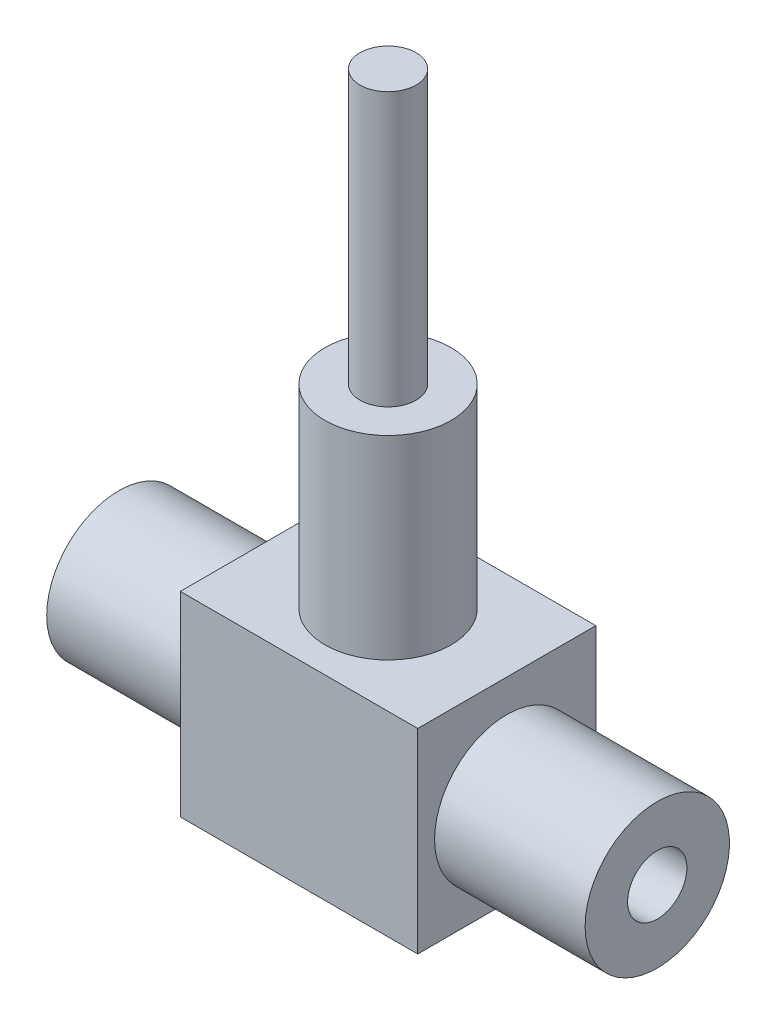
from build123d import *

# Parameters (mm, degrees)
BODY_SKETCH_W       = 25.4
BODY_SKETCH_H       = 20.9
BODY_DEPTH          = 9.525
NUT_X_SKETCH_W      = 16.1
NUT_X_SKETCH_H      = 7.722
NUT_X_SKETCH_2_W    = 16.1
NUT_X_SKETCH_2_H    = 7.722
SOCKET_X_SKETCH_W   = 16.2
SOCKET_X_SKETCH_H   = 3.175
SOCKET_X_SKETCH_2_W = 16.2
SOCKET_X_SKETCH_2_H = 3.175


with BuildPart() as part:
    # Body Sketch → Body (new, symmetric)
    with BuildSketch(Plane.XY):
        with Locations((0, 0.75)):
            Rectangle(BODY_SKETCH_W, BODY_SKETCH_H)
    extrude(amount=BODY_DEPTH, both=True)

    # Nut _X Sketch → Nut _X (revolve)
    with BuildSketch(Plane.XY):
        with Locations((20.75, 3.861)):
            Rectangle(NUT_X_SKETCH_W, NUT_X_SKETCH_H)
    revolve(axis=Axis((-1000, 0, 0), (1, 0, 0)))

    # Nut -X Sketch 2 → Nut -X 2 (revolve)
    with BuildSketch(Plane.XY):
        with Locations((-20.75, 3.861)):
            Rectangle(NUT_X_SKETCH_2_W, NUT_X_SKETCH_2_H)
    revolve(axis=Axis((-1000, 0, 0), (1, 0, 0)))

    # Socket _X Sketch → Socket _X (revolve, cut)
    with BuildSketch(Plane.XY):
        with Locations((21.7, 1.5875)):
            Rectangle(SOCKET_X_SKETCH_W, SOCKET_X_SKETCH_H)
    revolve(axis=Axis((-1000, 0, 0), (1, 0, 0)), mode=Mode.SUBTRACT)

    # Socket -X Sketch 2 → Socket -X 2 (revolve, cut)
    with BuildSketch(Plane.XY):
        with Locations((-21.7, 1.5875)):
            Rectangle(SOCKET_X_SKETCH_2_W, SOCKET_X_SKETCH_2_H)
    revolve(axis=Axis((-1000, 0, 0), (1, 0, 0)), mode=Mode.SUBTRACT)

    # Stem Sketch → Stem (revolve)
    with BuildSketch(Plane.XY):
        Polygon((0, 11.2), (6.75, 11.2), (6.75, 32), (3, 32), (3, 61.2), (0, 61.2), align=None)
    revolve(axis=Axis((0, -500, 0), (0, 1, 0)))


solid = part.part
